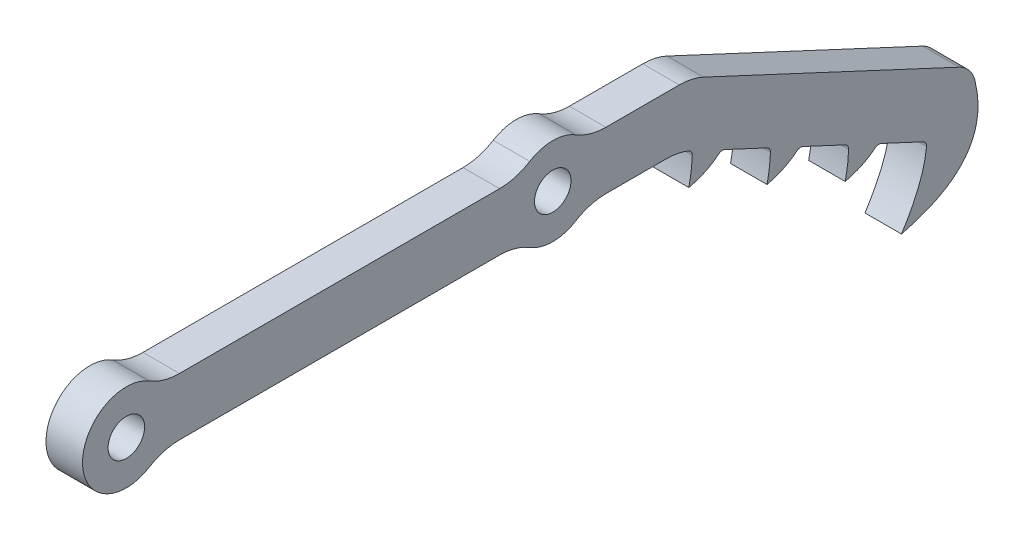
from build123d import *

# Parameters (mm, degrees)
BOSS_EXTRUDE1_DEPTH        = 6.35
F_1_4_0_2500_DOWEL_HOLE4_D = 6.35
FILLET1_R                  = 10
FILLET2_R                  = 10
FILLET4_R                  = 5
FILLET5_R                  = 1
FILLET6_R                  = 10


with BuildPart() as part:
    # Sketch1 → Boss-Extrude1 (new body)
    with BuildSketch(Plane(origin=(0, 0, 0), x_dir=(0, 0, -1), z_dir=(1, 0, 0))):
        with BuildLine():
            ThreePointArc((-34.29915969, 59.86223243), (-47.669324906, 54.86223243), (-34.29915969, 49.86223243))
            Line((-34.29915969, 49.86223243), (28.354545267, 49.86223243))
            ThreePointArc((28.354545267, 49.86223243), (34.104710482, 47.24223243), (39.854875697, 49.86223243))
            Line((39.854875697, 49.86223243), (56.104710487, 49.86223243))
            Line((56.104710487, 49.86223243), (58.379362515, 48.80154477))
            add(Edge.make_bspline(
                [(58.379362515, 48.80154477), (58.386228757, 46.363071997), (57.773854653, 43.567008128)],
                knots=[0, 0, 0, 1, 1, 1], degree=2))
            add(Edge.make_bspline(
                [(63.433148606, 46.444925613), (61.354068213, 44.407555536), (57.773854653, 43.567008128)],
                knots=[0.61808465, 0.61808465, 0.61808465, 1, 1, 1], degree=2))
            Line((63.433148606, 46.444925613), (71.973979321, 42.462270844))
            add(Edge.make_bspline(
                [(71.973979321, 42.462270844), (71.980845562, 40.023798071), (71.368471459, 37.227734202)],
                knots=[0, 0, 0, 1, 1, 1], degree=2))
            add(Edge.make_bspline(
                [(77.027765412, 40.105651687), (74.948685018, 38.06828161), (71.368471459, 37.227734202)],
                knots=[0.61808465, 0.61808465, 0.61808465, 1, 1, 1], degree=2))
            Line((77.027765412, 40.105651687), (85.568596126, 36.122996918))
            add(Edge.make_bspline(
                [(85.568596126, 36.122996918), (85.575462368, 33.684524145), (84.963088264, 30.888460276)],
                knots=[0, 0, 0, 1, 1, 1], degree=2))
            add(Edge.make_bspline(
                [(90.622382217, 33.766377761), (88.543301824, 31.729007684), (84.963088264, 30.888460276)],
                knots=[0.61808465, 0.61808465, 0.61808465, 1, 1, 1], degree=2))
            Line((90.622382217, 33.766377761), (99.163212932, 29.783722992))
            add(Edge.make_bspline(
                [(99.163212932, 29.783722992), (98.939072146, 24.65005498), (94.755179462, 18.075155142)],
                knots=[0, 0, 0, 1, 1, 1], degree=2))
            add(Edge.make_bspline(
                [(94.755179462, 18.075155142), (112.208752339, 22.33534385), (106.773416656, 37.268805905)],
                knots=[0.444949083, 0.444949083, 0.444949083, 1.444949083, 1.444949083, 1.444949083], degree=2))
            Line((106.773416656, 37.268805905), (79.825550101, 49.834802449))
            Line((79.825550101, 49.834802449), (58.321657114, 59.86223243))
            Line((58.321657114, 59.86223243), (39.854875697, 59.86223243))
            ThreePointArc((39.854875697, 59.86223243), (34.104710482, 62.48223243), (28.354545266, 59.86223243))
            Line((28.354545266, 59.86223243), (-34.29915969, 59.86223243))
        make_face()
    extrude(amount=BOSS_EXTRUDE1_DEPTH)

    # 1/4 (0.2500) Dowel Hole4 (through all)
    with Locations(Plane(origin=(6.35, 0, 0), x_dir=(0, 0, -1), z_dir=(1, 0, 0))):
        with Locations((-40.049324906, 54.86223243), (34.104710482, 54.86223243)):
            Hole(F_1_4_0_2500_DOWEL_HOLE4_D / 2)

    # Fillet1
    fillet1_edges = [part.edges().sort_by_distance(p)[0] for p in [
        (3.175, 49.86223243, 34.29915969),
        (3.175, 59.86223243, 34.29915969),
    ]]
    fillet(fillet1_edges, radius=FILLET1_R)

    # Fillet2
    fillet2_edges = [part.edges().sort_by_distance(p)[0] for p in [
        (3.175, 49.86223243, -56.104710487),
        (3.175, 59.86223243, -58.321657114),
    ]]
    fillet(fillet2_edges, radius=FILLET2_R)

    # Fillet4
    fillet4_edges = [part.edges().sort_by_distance(p)[0] for p in [
        (3.175, 37.268805905, -106.773416656),
    ]]
    fillet(fillet4_edges, radius=FILLET4_R)

    # Fillet5
    fillet5_edges = [part.edges().sort_by_distance(p)[0] for p in [
        (3.175, 33.766377761, -90.622382217),
        (3.175, 40.105651687, -77.027765412),
        (3.175, 46.444925613, -63.433148606),
        (3.175, 48.80154477, -58.379362515),
        (3.175, 42.462270844, -71.973979321),
        (3.175, 36.122996918, -85.568596126),
        (3.175, 29.783722992, -99.163212932),
    ]]
    fillet(fillet5_edges, radius=FILLET5_R)

    # Fillet6
    fillet6_edges = [part.edges().sort_by_distance(p)[0] for p in [
        (3.175, 49.86223243, -39.854875697),
        (3.175, 49.86223243, -28.354545267),
        (3.175, 59.86223243, -28.354545266),
        (3.175, 59.86223243, -39.854875697),
    ]]
    fillet(fillet6_edges, radius=FILLET6_R)


solid = part.part
